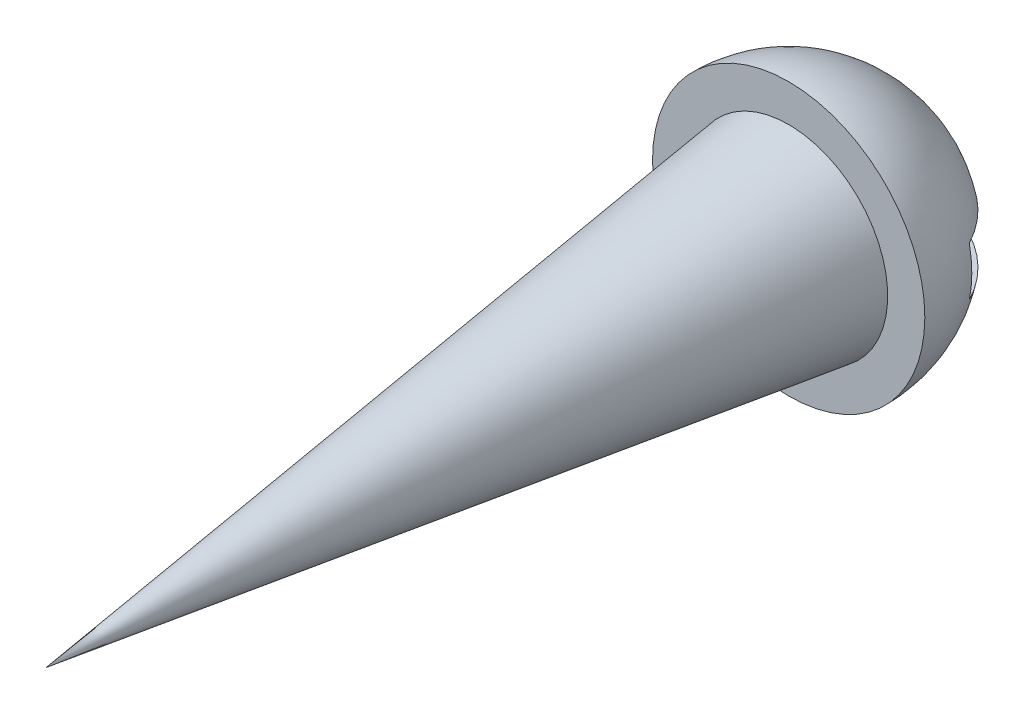
from build123d import *

# Parameters (mm, degrees)
REVOLVE2_ANGLE     = 180
SKETCH13_W         = 3
SKETCH13_H         = 1
CUT_EXTRUDE1_DEPTH = 5


with BuildPart() as part:
    # Sketch2 → Revolve1 (revolve)
    with BuildSketch(Plane(origin=(0, 0, 0), x_dir=(1, 0, 0), z_dir=(0, 1, 0)), mode=Mode.PRIVATE) as revolve1_sk:
        Polygon((0, 0), (2, 0), (0, -15), align=None)
    revolve(revolve1_sk.sketch.rotate(Axis((0, 0, 15), (0, 0, -1)), 180), axis=Axis((0, 0, 15), (0, 0, -1)))

    # Sketch12 → Revolve2 (revolve)
    with BuildSketch(Plane.XY):
        with BuildLine():
            Line((0, 2.75), (0, -2.75))
            ThreePointArc((0, -2.75), (-2.75, 0), (0, 2.75))
        make_face()
    revolve(axis=Axis((0, 2.75, 0), (0, -1, 0)), revolution_arc=REVOLVE2_ANGLE)

    # Sketch13 → Cut-Extrude1 (cut, symmetric)
    with BuildSketch(Plane(origin=(0, 0, 0), x_dir=(0, 0, -1), z_dir=(1, 0, 0))):
        with Locations((2.75, 0)):
            Rectangle(SKETCH13_W, SKETCH13_H)
    extrude(amount=CUT_EXTRUDE1_DEPTH, both=True, mode=Mode.SUBTRACT)


solid = part.part
